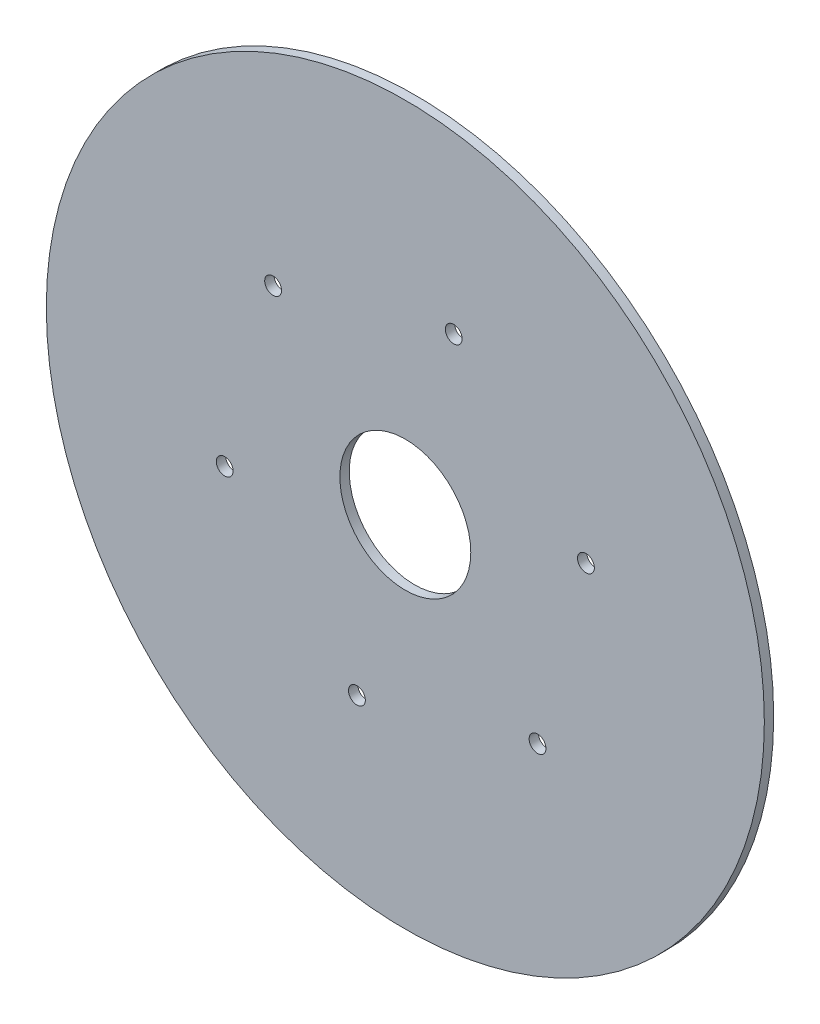
from build123d import *

# Parameters (mm, degrees)
FRONT_COVER_REFERENCE_START = 58.5
SKETCH_1_R                  = 96
SKETCH_1_R_2                = 17.5
FRONT_COVER_REFERENCE_DEPTH = 2.5
SKETCH_2_R                  = 2.25
THROUGH_HOLES_DEPTH         = 100


with BuildPart() as part:
    # Эскиз1 → Front_cover_reference (new body)
    with BuildSketch(Plane.XY.offset(FRONT_COVER_REFERENCE_START)):
        Circle(SKETCH_1_R)
        Circle(SKETCH_1_R_2, mode=Mode.SUBTRACT)
    extrude(amount=FRONT_COVER_REFERENCE_DEPTH)

    # Эскиз2 → Through_holes (cut, symmetric)
    with BuildSketch(Plane.XY):
        with Locations((48.296291314, 12.940952255)):
            Circle(SKETCH_2_R)
        with Locations((12.940952255, 48.296291314)):
            Circle(SKETCH_2_R)
        with Locations((-35.355339059, 35.355339059)):
            Circle(SKETCH_2_R)
        with Locations((-48.296291314, -12.940952255)):
            Circle(SKETCH_2_R)
        with Locations((-12.940952255, -48.296291314)):
            Circle(SKETCH_2_R)
        with Locations((35.355339059, -35.355339059)):
            Circle(SKETCH_2_R)
    extrude(amount=THROUGH_HOLES_DEPTH, both=True, mode=Mode.SUBTRACT)


solid = part.part
